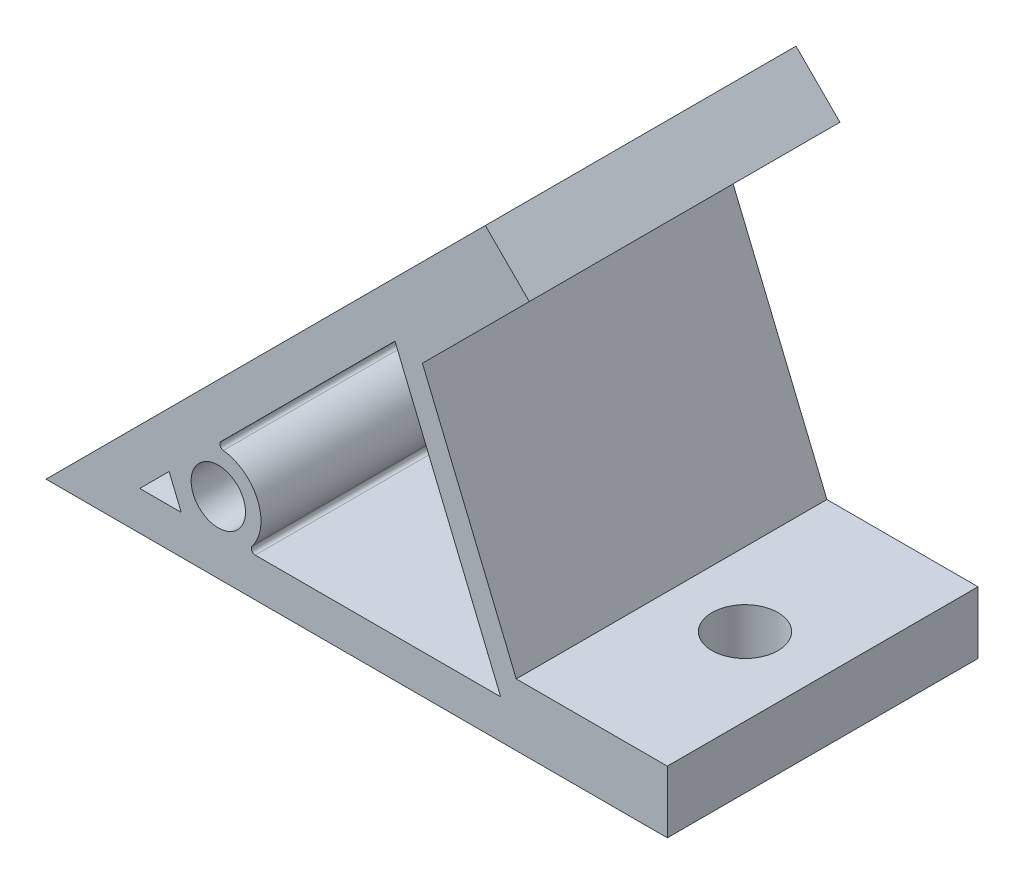
from build123d import *

# Parameters (mm, degrees)
SKETCH_1_R          = 3.5
EXTRUDE_1_DEPTH     = 20
SKETCH_2_R          = 4.25
CUT_EXTRUDE_1_DEPTH = 20
SKETCH_3_R          = 4.25
CUT_EXTRUDE_2_DEPTH = 20


with BuildPart() as part:
    # 草图1 → 凸台-拉伸1 (new, symmetric)
    with BuildSketch(Plane.XY):
        Polygon((0, 0), (56.568542495, 56.568542495), (62.225396744, 50.911688245), (48.470353518, 37.156645019), (60.547431318, 8), (80, 8), (80, 0), align=None)
        with Locations((22.184677187, 9.156473773)):
            Circle(SKETCH_1_R, mode=Mode.SUBTRACT)
        Polygon((12.071067812, 5), (15.847671377, 8.776603565), (17.411991793, 5), align=None, mode=Mode.SUBTRACT)
        with BuildLine():
            Line((22.539170943, 15.468103131), (44.931612237, 37.860544425))
            Line((44.931612237, 37.860544425), (58.542895405, 5))
            Line((58.542895405, 5), (26.941798117, 5))
            ThreePointArc((26.941798117, 5), (26.493271042, 5.27903968), (26.545371373, 5.804706148))
            ThreePointArc((26.545371373, 5.804706148), (27.253512915, 11.291164467), (22.833720405, 14.61804341))
            ThreePointArc((22.833720405, 14.61804341), (22.420282519, 14.950846558), (22.539170943, 15.468103131))
        make_face(mode=Mode.SUBTRACT)
    extrude(amount=EXTRUDE_1_DEPTH, both=True)

    # 草图2 → 切除-拉伸1 (cut)
    with BuildSketch(Plane(origin=(0, 0, 0), x_dir=(0, 0, 1), z_dir=(-0.7071067811865488, 0.7071067811865464, 0))):
        with Locations(Location((0, 70, 0), (0, 0, 270))):
            Circle(SKETCH_2_R)
    extrude(amount=-CUT_EXTRUDE_1_DEPTH, mode=Mode.SUBTRACT)

    # 草图3 → 切除-拉伸2 (cut)
    with BuildSketch(Plane.XZ):
        with Locations(Location((70, 0, 0), (0, 0, 270))):
            Circle(SKETCH_3_R)
    extrude(amount=-CUT_EXTRUDE_2_DEPTH, mode=Mode.SUBTRACT)


solid = part.part
